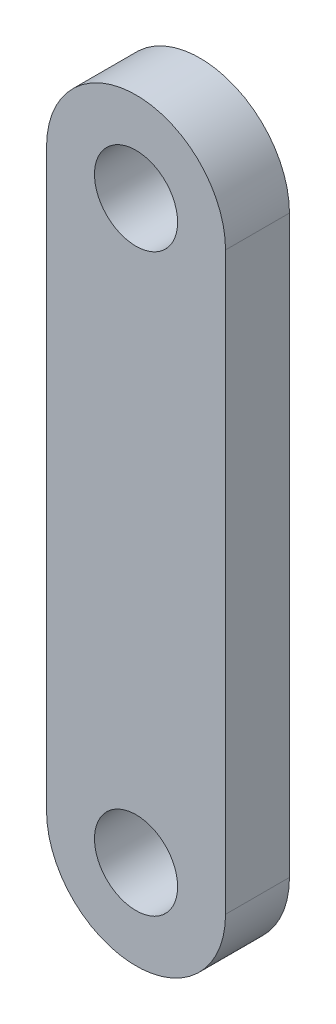
from build123d import *

# Parameters (mm, degrees)
BOSS_EXTRUDE1_DEPTH = 5
SKETCH2_R           = 3.25
CUT_EXTRUDE1_DEPTH  = 47.867848747


with BuildPart() as part:
    # Sketch1 → Boss-Extrude1 (new body)
    with BuildSketch(Plane.XY):
        with BuildLine():
            Line((-7, -39.071631686), (-7, 5.928368314))
            ThreePointArc((-7, 5.928368314), (0, 12.928368314), (7, 5.928368314))
            Line((7, 5.928368314), (7, -39.071631686))
            ThreePointArc((7, -39.071631686), (0, -46.071631686), (-7, -39.071631686))
        make_face()
    extrude(amount=BOSS_EXTRUDE1_DEPTH)

    # Sketch2 → Cut-Extrude1 (cut, through all)
    with BuildSketch(Plane.XY.offset(5)):
        with Locations((0, 5.928368314)):
            Circle(SKETCH2_R)
        with Locations((0, -39.071631686)):
            Circle(SKETCH2_R)
    extrude(amount=-CUT_EXTRUDE1_DEPTH, mode=Mode.SUBTRACT)


solid = part.part
